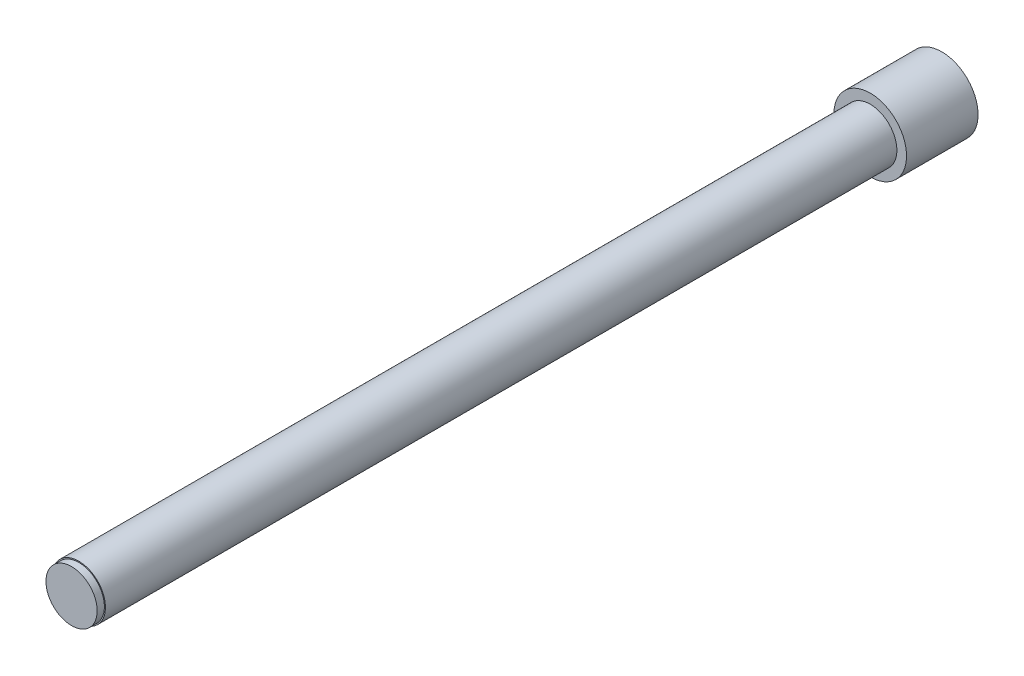
from build123d import *

# Parameters (mm, degrees)
SKETCH1_R           = 2.5
BOSS_EXTRUDE1_DEPTH = 40.767
SKETCH2_W           = 0.7
SKETCH2_H           = 0.1
SKETCH4_R           = 3.402225697
BOSS_EXTRUDE2_DEPTH = 6.701877401


with BuildPart() as part:
    # Sketch1 → Boss-Extrude1 (new, symmetric)
    with BuildSketch(Plane.XY):
        with Locations(Location((0, 0, 0), (0, 0, 180))):
            Circle(SKETCH1_R)
    extrude(amount=BOSS_EXTRUDE1_DEPTH, both=True)

    # Sketch2 → Cut-Revolve1 (revolve, cut)
    with BuildSketch(Plane(origin=(0, 0, 0), x_dir=(0, 0, -1), z_dir=(1, 0, 0)), mode=Mode.PRIVATE) as cut_revolve1_sk:
        with Locations((-40.441143952, 2.45)):
            Rectangle(SKETCH2_W, SKETCH2_H)
    revolve(cut_revolve1_sk.sketch.rotate(Axis((0, 0, 40.767), (0, 0, -1)), 270), axis=Axis((0, 0, 40.767), (0, 0, -1)), mode=Mode.SUBTRACT)

    # Sketch4 → Boss-Extrude2 (add)
    with BuildSketch(Plane(origin=(0, 0, -40.767), x_dir=(-1, 0, 0), z_dir=(0, 0, -1))):
        Circle(SKETCH4_R)
    extrude(amount=-BOSS_EXTRUDE2_DEPTH)


solid = part.part
